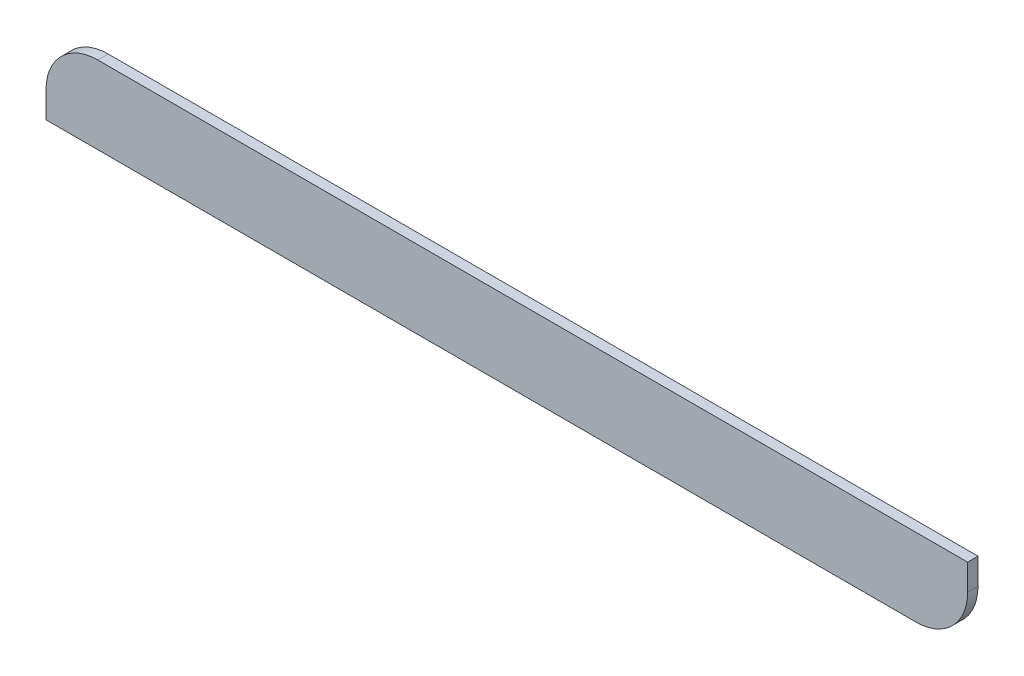
from build123d import *

# Parameters (mm, degrees)
BOSS_EXTRUDE1_DEPTH = 2


with BuildPart() as part:
    # Sketch1 → Boss-Extrude1 (new body)
    with BuildSketch(Plane.XY):
        with BuildLine():
            Line((-160.973915689, -6.861918673), (6.826084311, -6.861918673))
            Line((6.826084311, -6.861918673), (6.826084311, -11.861918673))
            ThreePointArc((6.826084311, -11.861918673), (3.897152123, -18.932986485), (-3.173915689, -21.861918673))
            Line((-3.173915689, -21.861918673), (-170.973915689, -21.861918673))
            Line((-170.973915689, -21.861918673), (-170.973915689, -16.861918673))
            ThreePointArc((-170.973915689, -16.861918673), (-168.0449835, -9.790850861), (-160.973915689, -6.861918673))
        make_face()
    extrude(amount=BOSS_EXTRUDE1_DEPTH)


solid = part.part
